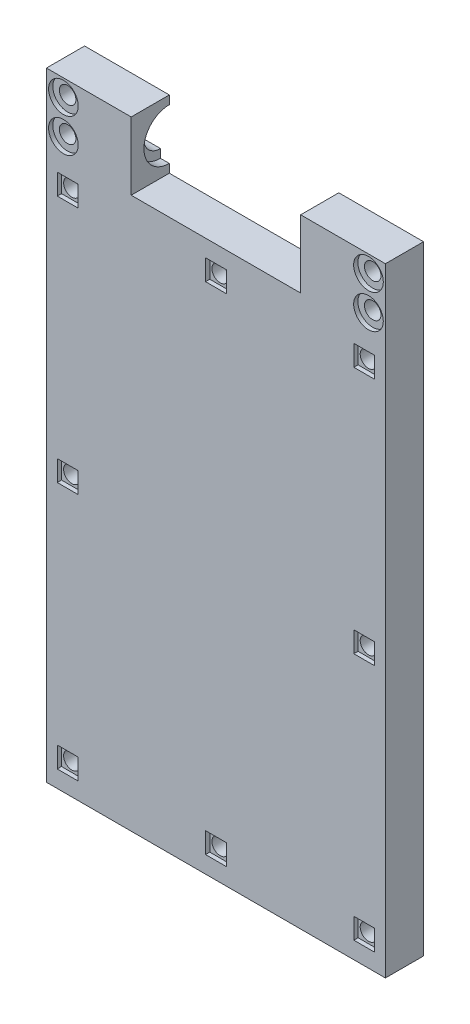
from build123d import *

# Parameters (mm, degrees)
IZIM1_W                       = 20
IZIM1_H                       = 16
Y_KSEKLIK_EKSTR_ZYON3_DEPTH   = 9
Y_KSEKLIK_EKSTR_ZYON3_2_DEPTH = 9
IZIM1_4_W                     = 72
IZIM1_4_H                     = 122
Y_KSEKLIK_EKSTR_ZYON4_DEPTH   = 3
IZIM1_5_W                     = 72
IZIM1_5_H                     = 122
Y_KSEKLIK_EKSTR_ZYON5_DEPTH   = 9
KES_EKSTR_ZYON5_DEPTH         = 52
KES_EKSTR_ZYON5_DEPTH_BACK    = 12
KES_EKSTR_ZYON6_DEPTH         = 42.08
KES_EKSTR_ZYON6_DEPTH_BACK    = 2.08
IZIM8_W                       = 77
IZIM8_H                       = 127
IZIM8_W_2                     = 75
IZIM8_H_2                     = 125
KES_EKSTR_ZYON9_DEPTH         = 1
IZIM9_W                       = 6.5
IZIM9_H                       = 4.5
KES_EKSTR_ZYON14_DEPTH        = 10
CENTIK_EKLEM_W                = 5
CENTIK_EKLEM_H                = 1.7
KES_EKSTR_ZYON15_DEPTH        = 6
IZIM17_W                      = 3.45
IZIM17_H                      = 4.9
IZIM17_W_2                    = 4.9
Y_KSEKLIK_EKSTR_ZYON6_DEPTH   = 6
SOMUN_YUVALAR_R               = 1
KES_EKSTR_ZYON16_DEPTH        = 9
SOMUN_YUVALAR_3_R             = 1.95
SOMUN_YUVALAR_3_R_2           = 1
KES_EKSTR_ZYON17_DEPTH        = 4
SOMUN_YUVALAR_4_W             = 4.9
SOMUN_YUVALAR_4_H             = 4.9
SOMUN_YUVALAR_4_R             = 1.95
SOMUN_YUVALAR_4_R_2           = 3.5
KES_EKSTR_ZYON18_DEPTH        = 1


with BuildPart() as part:
    # Çizim1 → Yükseklik-Ekstrüzyon3 (new body)
    with BuildSketch(Plane.XY):
        with Locations((-38.971656999, 91.167836594)):
            Rectangle(IZIM1_W, IZIM1_H)
    extrude(amount=-Y_KSEKLIK_EKSTR_ZYON3_DEPTH)



with BuildPart() as body_2:
    # Çizim1 → Y_kseklik-Ekstr_zyon3 2 (new body)
    with BuildSketch(Plane.XY):
        with Locations((21.028343001, 91.167836594)):
            Rectangle(IZIM1_W, IZIM1_H)
    extrude(amount=-Y_KSEKLIK_EKSTR_ZYON3_2_DEPTH)


with BuildPart() as body_3:
    # Çizim1<4> → Yükseklik-Ekstrüzyon4 (new body)
    with BuildSketch(Plane.XY):
        with Locations((-8.971656999, 18.167836594)):
            Rectangle(IZIM1_4_W, IZIM1_4_H)
    extrude(amount=-Y_KSEKLIK_EKSTR_ZYON4_DEPTH)


with BuildPart() as part_1:
    add(part.part)

    add(body_2.part)  # Yükseklik-Ekstrüzyon5 merges body 2

    add(body_3.part)  # Yükseklik-Ekstrüzyon5 merges body 3
    # Çizim1<5> → Yükseklik-Ekstrüzyon5 (add)
    with BuildSketch(Plane.XY):
        Polygon((-28.971656999, 83.167836594), (-48.971656999, 83.167836594), (-48.971656999, -46.832163406), (31.028343001, -46.832163406), (31.028343001, 83.167836594), (11.028343001, 83.167836594), align=None)
        with Locations((-8.971656999, 18.167836594)):
            Rectangle(IZIM1_5_W, IZIM1_5_H, mode=Mode.SUBTRACT)
    extrude(amount=-Y_KSEKLIK_EKSTR_ZYON5_DEPTH)

    # Çizim2 → Kes-Ekstrüzyon5 (cut, two sides: drawn at the far end of the back side and taken through both)
    with BuildSketch(Plane(origin=(-28.971656999, 0, 0), x_dir=(0, 0, -1), z_dir=(1, 0, 0)).offset(-KES_EKSTR_ZYON5_DEPTH_BACK)):
        with BuildLine():
            Line((9, 87.167836594), (9, 95.167836594))
            ThreePointArc((9, 95.167836594), (5, 91.167836594), (9, 87.167836594))
        make_face()
    extrude(amount=KES_EKSTR_ZYON5_DEPTH + KES_EKSTR_ZYON5_DEPTH_BACK, mode=Mode.SUBTRACT)

    # Çizim2<3> → Kes-Ekstrüzyon6 (cut, two sides: drawn at the far end of the back side and taken through both)
    with BuildSketch(Plane(origin=(-28.971656999, 0, 0), x_dir=(0, 0, -1), z_dir=(1, 0, 0)).offset(-KES_EKSTR_ZYON6_DEPTH_BACK)):
        with BuildLine():
            Line((9, 95.167836594), (9, 97.167836594))
            ThreePointArc((9, 97.167836594), (3, 91.167836594), (9, 85.167836594))
            Line((9, 85.167836594), (9, 87.167836594))
            ThreePointArc((9, 87.167836594), (5, 91.167836594), (9, 95.167836594))
        make_face()
    extrude(amount=KES_EKSTR_ZYON6_DEPTH + KES_EKSTR_ZYON6_DEPTH_BACK, mode=Mode.SUBTRACT)

    # Çizim8 → Kes-Ekstrüzyon9 (cut)
    with BuildSketch(Plane(origin=(0, 0, -9), x_dir=(-1, 0, 0), z_dir=(0, 0, -1))):
        with Locations((8.971656999, 18.167836594)):
            Rectangle(IZIM8_W, IZIM8_H)
        with Locations((8.971656999, 18.167836594)):
            Rectangle(IZIM8_W_2, IZIM8_H_2, mode=Mode.SUBTRACT)
    extrude(amount=-KES_EKSTR_ZYON9_DEPTH, mode=Mode.SUBTRACT)

    # Çizim9 → Kes-Ekstrüzyon14 (cut)
    with BuildSketch(Plane.XZ.offset(-79.167836594)):
        with Locations((-37.721656999, -5.25)):
            Rectangle(IZIM9_W, IZIM9_H)
        with Locations((19.778343001, -5.25)):
            Rectangle(IZIM9_W, IZIM9_H)
    extrude(amount=-KES_EKSTR_ZYON14_DEPTH, mode=Mode.SUBTRACT)

    # centik_eklem → Kes-Ekstrüzyon15 (cut)
    with BuildSketch(Plane(origin=(0, 0, -9), x_dir=(-1, 0, 0), z_dir=(0, 0, -1))):
        with Locations((-19.528343001, 97.417836594)):
            Rectangle(CENTIK_EKLEM_W, CENTIK_EKLEM_H)
        with Locations((-19.528343001, 84.917836594)):
            Rectangle(CENTIK_EKLEM_W, CENTIK_EKLEM_H)
        with Locations((37.471656999, 84.917836594)):
            Rectangle(CENTIK_EKLEM_W, CENTIK_EKLEM_H)
        with Locations((37.471656999, 97.417836594)):
            Rectangle(CENTIK_EKLEM_W, CENTIK_EKLEM_H)
    extrude(amount=-KES_EKSTR_ZYON15_DEPTH, mode=Mode.SUBTRACT)

    # Çizim17 → Yükseklik-Ekstrüzyon6 (add)
    with BuildSketch(Plane(origin=(0, 0, -3), x_dir=(-1, 0, 0), z_dir=(0, 0, -1))):
        with Locations((-25.303343001, 76.717836594)):
            Rectangle(IZIM17_W, IZIM17_H)
        with Locations((-25.303343001, 18.167836594)):
            Rectangle(IZIM17_W, IZIM17_H)
        with Locations((8.971656999, 76.717836594)):
            Rectangle(IZIM17_W_2, IZIM17_H)
        with Locations((-25.303343001, -40.382163406)):
            Rectangle(IZIM17_W, IZIM17_H)
        with Locations((43.246656999, 76.717836594)):
            Rectangle(IZIM17_W, IZIM17_H)
        with Locations((8.971656999, -40.382163406)):
            Rectangle(IZIM17_W_2, IZIM17_H)
        Polygon((44.971656999, 15.686169924), (44.971656999, 20.617836594), (41.521656999, 20.617836594), (41.521656999, 15.717836594), align=None)
        with Locations((43.246656999, -40.382163406)):
            Rectangle(IZIM17_W, IZIM17_H)
    extrude(amount=Y_KSEKLIK_EKSTR_ZYON6_DEPTH)

    # somun_yuvalar → Kes-Ekstrüzyon16 (cut)
    with BuildSketch(Plane.XY):
        with Locations((-8.971656999, 76.717836594)):
            Circle(SOMUN_YUVALAR_R)
        with Locations((-44.971656999, 87.167836594)):
            Circle(SOMUN_YUVALAR_R)
        with Locations((-44.971656999, 95.167836594)):
            Circle(SOMUN_YUVALAR_R)
        with Locations((27.028343001, 95.167836594)):
            Circle(SOMUN_YUVALAR_R)
        with Locations((27.028343001, 87.167836594)):
            Circle(SOMUN_YUVALAR_R)
        with Locations((26.028343001, 76.717836594)):
            Circle(SOMUN_YUVALAR_R)
        with Locations((-43.971656999, 76.717836594)):
            Circle(SOMUN_YUVALAR_R)
        with Locations((-8.971656999, -40.382163406)):
            Circle(SOMUN_YUVALAR_R)
        with Locations((26.028343001, -40.382163406)):
            Circle(SOMUN_YUVALAR_R)
        with Locations((-43.971656999, -40.382163406)):
            Circle(SOMUN_YUVALAR_R)
        with Locations((-43.971656999, 18.167836594)):
            Circle(SOMUN_YUVALAR_R)
        with Locations((26.028343001, 18.167836594)):
            Circle(SOMUN_YUVALAR_R)
    extrude(amount=-KES_EKSTR_ZYON16_DEPTH, mode=Mode.SUBTRACT)

    # somun_yuvalar<3> → Kes-Ekstrüzyon17 (cut)
    # profile 1 of 12: a face of its own
    with BuildSketch(Plane.XY):
        with Locations((27.028343001, 95.167836594)):
            Circle(SOMUN_YUVALAR_3_R)
        with Locations((27.028343001, 95.167836594)):
            Circle(SOMUN_YUVALAR_3_R_2, mode=Mode.SUBTRACT)
    # profile 2 of 12: a face of its own
    with BuildSketch(Plane.XY):
        with Locations((27.028343001, 87.167836594)):
            Circle(SOMUN_YUVALAR_3_R)
        with Locations((27.028343001, 87.167836594)):
            Circle(SOMUN_YUVALAR_3_R_2, mode=Mode.SUBTRACT)
    # profile 3 of 12: a face of its own
    with BuildSketch(Plane.XY):
        with Locations((-44.971656999, 87.167836594)):
            Circle(SOMUN_YUVALAR_3_R)
        with Locations((-44.971656999, 87.167836594)):
            Circle(SOMUN_YUVALAR_3_R_2, mode=Mode.SUBTRACT)
    # profile 4 of 12: a face of its own
    with BuildSketch(Plane.XY):
        with Locations((-44.971656999, 95.167836594)):
            Circle(SOMUN_YUVALAR_3_R)
        with Locations((-44.971656999, 95.167836594)):
            Circle(SOMUN_YUVALAR_3_R_2, mode=Mode.SUBTRACT)
    # profile 5 of 12: a face of its own
    with BuildSketch(Plane.XY):
        with Locations((-8.971656999, 76.717836594)):
            Circle(SOMUN_YUVALAR_3_R)
        with Locations((-8.971656999, 76.717836594)):
            Circle(SOMUN_YUVALAR_3_R_2, mode=Mode.SUBTRACT)
    # profile 6 of 12: a face of its own
    with BuildSketch(Plane.XY):
        with Locations((26.028343001, 76.717836594)):
            Circle(SOMUN_YUVALAR_3_R)
        with Locations((26.028343001, 76.717836594)):
            Circle(SOMUN_YUVALAR_3_R_2, mode=Mode.SUBTRACT)
    # profile 7 of 12: a face of its own
    with BuildSketch(Plane.XY):
        with Locations((-43.971656999, 76.717836594)):
            Circle(SOMUN_YUVALAR_3_R)
        with Locations((-43.971656999, 76.717836594)):
            Circle(SOMUN_YUVALAR_3_R_2, mode=Mode.SUBTRACT)
    # profile 8 of 12: a face of its own
    with BuildSketch(Plane.XY):
        with Locations((26.028343001, -40.382163406)):
            Circle(SOMUN_YUVALAR_3_R)
        with Locations((26.028343001, -40.382163406)):
            Circle(SOMUN_YUVALAR_3_R_2, mode=Mode.SUBTRACT)
    # profile 9 of 12: a face of its own
    with BuildSketch(Plane.XY):
        with Locations((-8.971656999, -40.382163406)):
            Circle(SOMUN_YUVALAR_3_R)
        with Locations((-8.971656999, -40.382163406)):
            Circle(SOMUN_YUVALAR_3_R_2, mode=Mode.SUBTRACT)
    # profile 10 of 12: a face of its own
    with BuildSketch(Plane.XY):
        with Locations((-43.971656999, -40.382163406)):
            Circle(SOMUN_YUVALAR_3_R)
        with Locations((-43.971656999, -40.382163406)):
            Circle(SOMUN_YUVALAR_3_R_2, mode=Mode.SUBTRACT)
    # profile 11 of 12: a face of its own
    with BuildSketch(Plane.XY):
        with Locations((-43.971656999, 18.167836594)):
            Circle(SOMUN_YUVALAR_3_R)
        with Locations((-43.971656999, 18.167836594)):
            Circle(SOMUN_YUVALAR_3_R_2, mode=Mode.SUBTRACT)
    # profile 12 of 12: a face of its own
    with BuildSketch(Plane.XY):
        with Locations((26.028343001, 18.167836594)):
            Circle(SOMUN_YUVALAR_3_R)
        with Locations((26.028343001, 18.167836594)):
            Circle(SOMUN_YUVALAR_3_R_2, mode=Mode.SUBTRACT)
    extrude(amount=-KES_EKSTR_ZYON17_DEPTH, mode=Mode.SUBTRACT)

    # somun_yuvalar<4> → Kes-Ekstrüzyon18 (cut)
    # profile 1 of 12: a face of its own
    with BuildSketch(Plane.XY):
        with Locations((-8.971656999, 76.717836594)):
            Rectangle(SOMUN_YUVALAR_4_W, SOMUN_YUVALAR_4_H)
        with Locations((-8.971656999, 76.717836594)):
            Circle(SOMUN_YUVALAR_4_R, mode=Mode.SUBTRACT)
    # profile 2 of 12: a face of its own
    with BuildSketch(Plane.XY):
        with Locations((26.028343001, 76.717836594)):
            Rectangle(SOMUN_YUVALAR_4_W, SOMUN_YUVALAR_4_H)
        with Locations((26.028343001, 76.717836594)):
            Circle(SOMUN_YUVALAR_4_R, mode=Mode.SUBTRACT)
    # profile 3 of 12: a face of its own
    with BuildSketch(Plane.XY):
        with Locations((-43.971656999, 76.717836594)):
            Rectangle(SOMUN_YUVALAR_4_W, SOMUN_YUVALAR_4_H)
        with Locations((-43.971656999, 76.717836594)):
            Circle(SOMUN_YUVALAR_4_R, mode=Mode.SUBTRACT)
    # profile 4 of 12: a face of its own
    with BuildSketch(Plane.XY):
        with Locations((-8.971656999, -40.382163406)):
            Rectangle(SOMUN_YUVALAR_4_W, SOMUN_YUVALAR_4_H)
        with Locations((-8.971656999, -40.382163406)):
            Circle(SOMUN_YUVALAR_4_R, mode=Mode.SUBTRACT)
    # profile 5 of 12: a face of its own
    with BuildSketch(Plane.XY):
        with Locations((26.028343001, -40.382163406)):
            Rectangle(SOMUN_YUVALAR_4_W, SOMUN_YUVALAR_4_H)
        with Locations((26.028343001, -40.382163406)):
            Circle(SOMUN_YUVALAR_4_R, mode=Mode.SUBTRACT)
    # profile 6 of 12: a face of its own
    with BuildSketch(Plane.XY):
        with Locations((-43.971656999, -40.382163406)):
            Rectangle(SOMUN_YUVALAR_4_W, SOMUN_YUVALAR_4_H)
        with Locations((-43.971656999, -40.382163406)):
            Circle(SOMUN_YUVALAR_4_R, mode=Mode.SUBTRACT)
    # profile 7 of 12: a face of its own
    with BuildSketch(Plane.XY):
        with Locations((-43.971656999, 18.167836594)):
            Rectangle(SOMUN_YUVALAR_4_W, SOMUN_YUVALAR_4_H)
        with Locations((-43.971656999, 18.167836594)):
            Circle(SOMUN_YUVALAR_4_R, mode=Mode.SUBTRACT)
    # profile 8 of 12: a face of its own
    with BuildSketch(Plane.XY):
        with Locations((26.028343001, 18.167836594)):
            Rectangle(SOMUN_YUVALAR_4_W, SOMUN_YUVALAR_4_H)
        with Locations((26.028343001, 18.167836594)):
            Circle(SOMUN_YUVALAR_4_R, mode=Mode.SUBTRACT)
    # profile 9 of 12: a face of its own
    with BuildSketch(Plane.XY):
        with Locations((27.028343001, 95.167836594)):
            Circle(SOMUN_YUVALAR_4_R_2)
    # profile 10 of 12: a face of its own
    with BuildSketch(Plane.XY):
        with Locations((27.028343001, 87.167836594)):
            Circle(SOMUN_YUVALAR_4_R_2)
    # profile 11 of 12: a face of its own
    with BuildSketch(Plane.XY):
        with Locations((-44.971656999, 87.167836594)):
            Circle(SOMUN_YUVALAR_4_R_2)
    # profile 12 of 12: a face of its own
    with BuildSketch(Plane.XY):
        with Locations((-44.971656999, 95.167836594)):
            Circle(SOMUN_YUVALAR_4_R_2)
    extrude(amount=-KES_EKSTR_ZYON18_DEPTH, mode=Mode.SUBTRACT)


solid = part_1.part
